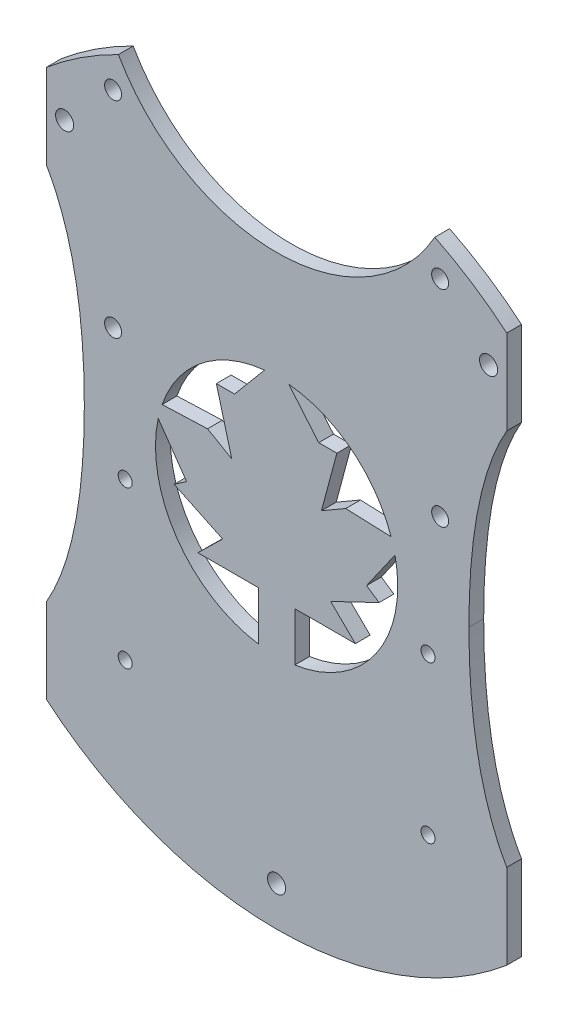
from build123d import *

# Parameters (mm, degrees)
SKETCH1_R           = 1.89865
BOSS_EXTRUDE3_DEPTH = 3.0988
SKETCH2_R           = 1.4732
CUT_EXTRUDE1_DEPTH  = 3.0988
CUT_EXTRUDE2_DEPTH  = 3.0988
SKETCH4_R           = 1.778
CUT_EXTRUDE3_DEPTH  = 3.0988
CUT_EXTRUDE4_DEPTH  = 3.0988


with BuildPart() as part:
    # Sketch1 → Boss-Extrude3 (new body)
    with BuildSketch(Plane.XY):
        with BuildLine():
            Line((-48.26, 57.410560004), (-48.26, -57.410560004))
            ThreePointArc((-48.26, -57.410560004), (0, -75), (48.26, -57.410560004))
            Line((48.26, -57.410560004), (48.26, 57.410560004))
            ThreePointArc((48.26, 57.410560004), (41.013374249, 62.792540423), (33.172661219, 67.264957799))
            ThreePointArc((33.172661219, 67.264957799), (0, 47.904876359), (-33.172661219, 67.264957799))
            ThreePointArc((-33.172661219, 67.264957799), (-41.013374249, 62.792540423), (-48.26, 57.410560004))
        make_face()
        with Locations((0, -66.675)):
            Circle(SKETCH1_R, mode=Mode.SUBTRACT)
        with Locations((-44.45, 49.6966108)):
            Circle(SKETCH1_R, mode=Mode.SUBTRACT)
        with Locations(Location((44.45, 49.6966108, 0), (0, 0, 180))):
            Circle(SKETCH1_R, mode=Mode.SUBTRACT)
    extrude(amount=BOSS_EXTRUDE3_DEPTH)

    # Sketch2 → Cut-Extrude1 (cut)
    with BuildSketch(Plane.XY.offset(3.0988)):
        with Locations((-31.75, -41.98)):
            Circle(SKETCH2_R)
        with Locations((31.75, -41.98)):
            Circle(SKETCH2_R)
        with Locations((-31.75, -9.1251)):
            Circle(SKETCH2_R)
        with Locations((31.75, -9.1251)):
            Circle(SKETCH2_R)
    extrude(amount=-CUT_EXTRUDE1_DEPTH, mode=Mode.SUBTRACT)

    # Sketch3 → Cut-Extrude2 (cut)
    with BuildSketch(Plane.XY.offset(3.0988)):
        with BuildLine():
            Line((8.827105782, 17.78), (2.54, 25.272680903))
            ThreePointArc((2.54, 25.272680903), (15.758317518, 19.920728626), (24.009298775, 8.289365013))
            Line((24.009298775, 8.289365013), (14.484298775, 8.647939367))
            Line((14.484298775, 8.647939367), (9.404298775, 5.715))
            Line((9.404298775, 5.715), (12.637105782, 17.78))
            Line((12.637105782, 17.78), (8.827105782, 17.78))
        make_face()
        with BuildLine():
            Line((18.868143133, -3.140634987), (24.826209076, 5.368365013))
            ThreePointArc((24.826209076, 5.368365013), (20.911260009, -14.418016674), (3.81, -25.112624315))
            Line((3.81, -25.112624315), (3.81, -14.877877919))
            Line((3.81, -14.877877919), (16.51, -14.877877919))
            Line((16.51, -14.877877919), (11.327081569, -9.797877919))
            Line((11.327081569, -9.797877919), (21.487081569, -4.935568543))
            Line((21.487081569, -4.935568543), (18.868143133, -3.140634987))
        make_face()
        with BuildLine():
            Line((-3.81, -14.877877919), (-3.81, -25.112624315))
            ThreePointArc((-3.81, -25.112624315), (-20.911260009, -14.418016674), (-24.826209076, 5.368365013))
            Line((-24.826209076, 5.368365013), (-18.868143133, -3.140634987))
            Line((-18.868143133, -3.140634987), (-21.487081569, -4.935568543))
            Line((-21.487081569, -4.935568543), (-11.327081569, -9.797877919))
            Line((-11.327081569, -9.797877919), (-16.51, -14.877877919))
            Line((-16.51, -14.877877919), (-3.81, -14.877877919))
        make_face()
        with BuildLine():
            Line((-14.484298775, 8.647939367), (-24.009298775, 8.289365013))
            ThreePointArc((-24.009298775, 8.289365013), (-15.758317518, 19.920728626), (-2.54, 25.272680903))
            Line((-2.54, 25.272680903), (-8.827105782, 17.78))
            Line((-8.827105782, 17.78), (-12.637105782, 17.78))
            Line((-12.637105782, 17.78), (-9.404298775, 5.715))
            Line((-9.404298775, 5.715), (-14.484298775, 8.647939367))
        make_face()
    extrude(amount=-CUT_EXTRUDE2_DEPTH, mode=Mode.SUBTRACT)

    # Sketch4 → Cut-Extrude3 (cut)
    with BuildSketch(Plane.XY.offset(3.0988)):
        with Locations((-34.29, 60.279957799)):
            Circle(SKETCH4_R)
        with Locations((34.29, 60.279957799)):
            Circle(SKETCH4_R)
        with Locations((34.29, 17.099957799)):
            Circle(SKETCH4_R)
        with Locations((-34.29, 17.099957799)):
            Circle(SKETCH4_R)
    extrude(amount=-CUT_EXTRUDE3_DEPTH, mode=Mode.SUBTRACT)

    # Sketch5 → Cut-Extrude4 (cut)
    with BuildSketch(Plane.XY.offset(3.0988)):
        with BuildLine():
            Line((48.26, 39.630560004), (48.26, -39.630560004))
            add(Edge.make_bspline(
                [(48.26, -39.630560004), (40.3225, -25.882406719), (40.3225, 0)],
                knots=[0, 0, 0, 1, 1, 1], degree=2))
            add(Edge.make_bspline(
                [(48.26, 39.630560004), (40.3225, 25.882406719), (40.3225, 0)],
                knots=[0, 0, 0, 1, 1, 1], degree=2))
        make_face()
        with BuildLine():
            Line((-48.26, 39.630560004), (-48.26, -39.630560004))
            add(Edge.make_bspline(
                [(-48.26, -39.630560004), (-40.3225, -25.882406719), (-40.3225, 0)],
                knots=[0, 0, 0, 1, 1, 1], degree=2))
            add(Edge.make_bspline(
                [(-48.26, 39.630560004), (-40.3225, 25.882406719), (-40.3225, 0)],
                knots=[0, 0, 0, 1, 1, 1], degree=2))
        make_face()
    extrude(amount=-CUT_EXTRUDE4_DEPTH, mode=Mode.SUBTRACT)


solid = part.part
